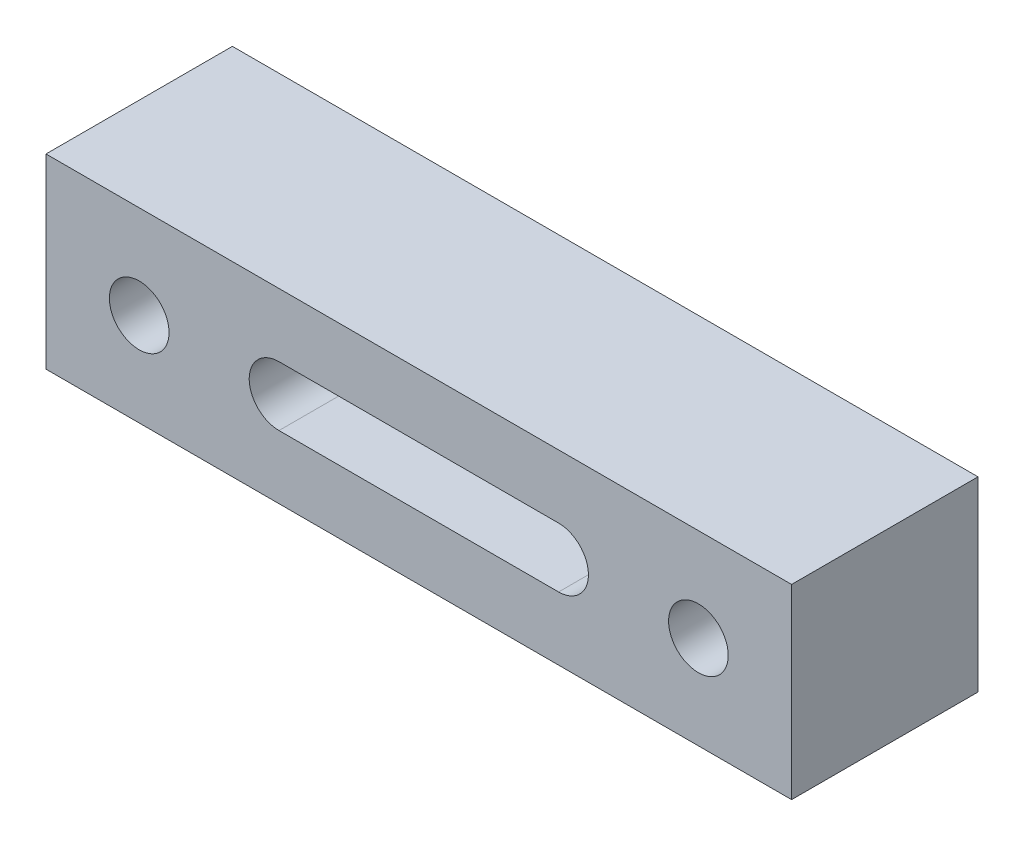
from build123d import *

# Parameters (mm, degrees)
SKETCH_1_W          = 40
SKETCH_1_H          = 10
SKETCH_1_R          = 1.6
EXTRUDE_1_DEPTH     = 10
SKETCH_2_W          = 20
SKETCH_2_H          = 6
CUT_EXTRUDE_1_DEPTH = 6


with BuildPart() as part:
    # 草图1 → 凸台-拉伸1 (new body)
    with BuildSketch(Plane.XY):
        with Locations((-6.818181818, 13.588516746)):
            Rectangle(SKETCH_1_W, SKETCH_1_H)
        with Locations((-21.818181818, 13.588516746)):
            Circle(SKETCH_1_R, mode=Mode.SUBTRACT)
        with Locations((8.181818182, 13.588516746)):
            Circle(SKETCH_1_R, mode=Mode.SUBTRACT)
        with BuildLine():
            Line((-14.318181818, 15.188516746), (0.681818182, 15.188516746))
            ThreePointArc((0.681818182, 15.188516746), (2.281818182, 13.588516746), (0.681818182, 11.988516746))
            Line((0.681818182, 11.988516746), (-14.318181818, 11.988516746))
            ThreePointArc((-14.318181818, 11.988516746), (-15.918181818, 13.588516746), (-14.318181818, 15.188516746))
        make_face(mode=Mode.SUBTRACT)
    extrude(amount=EXTRUDE_1_DEPTH)

    # 草图2 → 切除-拉伸1 (cut)
    with BuildSketch(Plane(origin=(0, 0, 0), x_dir=(-1, 0, 0), z_dir=(0, 0, -1))):
        with Locations((6.818181818, 13.588516746)):
            Rectangle(SKETCH_2_W, SKETCH_2_H)
    extrude(amount=-CUT_EXTRUDE_1_DEPTH, mode=Mode.SUBTRACT)


solid = part.part
